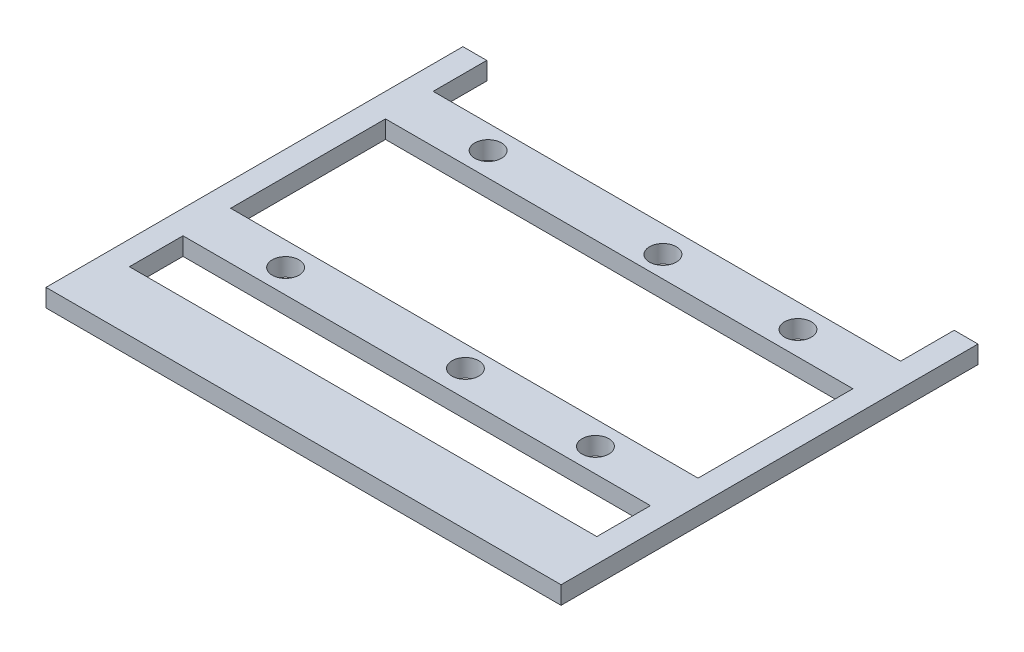
from build123d import *

# Parameters (mm, degrees)
SKETCH3_R           = 2.25
SKETCH3_W           = 78.47813411
SKETCH3_H           = 26
BOSS_EXTRUDE1_DEPTH = 3
SKETCH4_W           = 86.47813411
SKETCH4_H           = 3
BOSS_EXTRUDE2_DEPTH = 10


with BuildPart() as part:
    # Sketch3 → Boss-Extrude1 (new body)
    with BuildSketch(Plane(origin=(0, 0, 0), x_dir=(1, 0, 0), z_dir=(0, 1, 0))):
        Polygon((-43.239067055, -30), (-43.239067055, 30), (-39.239067055, 30), (-39.239067055, 21), (39.239067055, 21), (39.239067055, 30), (43.239067055, 30), (43.239067055, -30), (39.239067055, -30), (39.239067055, -21), (-39.239067055, -21), (-39.239067055, -30), align=None)
        with Locations(Location((-26.009067055, 17, 0), (0, 0, 270))):
            Circle(SKETCH3_R, mode=Mode.SUBTRACT)
        with Locations(Location((3.760932945, 16.578763023, 0), (0, 0, 270))):
            Circle(SKETCH3_R, mode=Mode.SUBTRACT)
        with Locations(Location((26.009067055, 17, 0), (0, 0, 270))):
            Circle(SKETCH3_R, mode=Mode.SUBTRACT)
        with Locations(Location((26.009067055, -17, 0), (0, 0, 90))):
            Circle(SKETCH3_R, mode=Mode.SUBTRACT)
        with Locations(Location((3.760932945, -16.578763023, 0), (0, 0, 90))):
            Circle(SKETCH3_R, mode=Mode.SUBTRACT)
        with Locations(Location((-26.009067055, -17, 0), (0, 0, 90))):
            Circle(SKETCH3_R, mode=Mode.SUBTRACT)
        Rectangle(SKETCH3_W, SKETCH3_H, mode=Mode.SUBTRACT)
    extrude(amount=BOSS_EXTRUDE1_DEPTH)

    # Sketch4 → Boss-Extrude2 (add)
    with BuildSketch(Plane.XY.offset(30)):
        with Locations((0, 1.5)):
            Rectangle(SKETCH4_W, SKETCH4_H)
    extrude(amount=BOSS_EXTRUDE2_DEPTH)


solid = part.part
